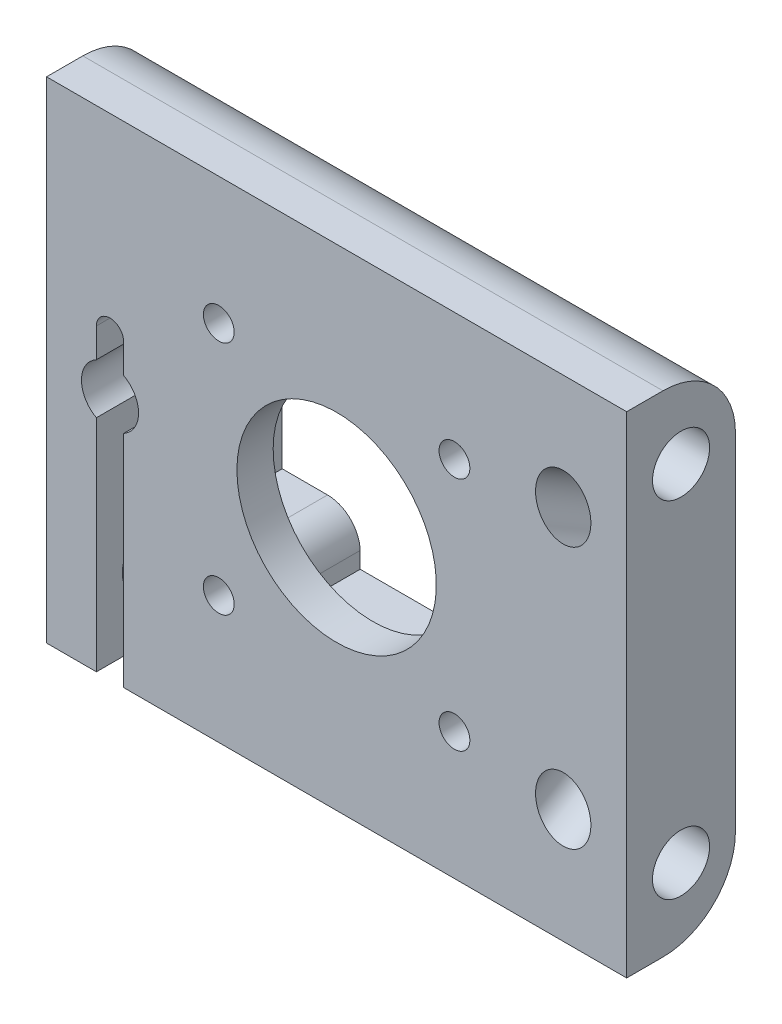
from build123d import *

# Parameters (mm, degrees)
SKETCH1_W           = 64
SKETCH1_H           = 54.105
BOSS_EXTRUDE1_DEPTH = 12
SKETCH2_R           = 3.15
CUT_EXTRUDE1_DEPTH  = 85.660209219
FILLET1_R           = 8
SKETCH3_R           = 11
SKETCH3_R_2         = 1.7
CUT_EXTRUDE2_DEPTH  = 85.660209219
CUT_EXTRUDE4_DEPTH  = 8
CUT_EXTRUDE5_START  = -85.903698808
SKETCH6_R           = 3.05
CUT_EXTRUDE5_DEPTH  = 93.903698808


with BuildPart() as part:
    # Sketch1 → Boss-Extrude1 (new body)
    with BuildSketch(Plane.XY):
        with Locations((32, 27.0525)):
            Rectangle(SKETCH1_W, SKETCH1_H)
    extrude(amount=BOSS_EXTRUDE1_DEPTH)

    # Sketch2 → Cut-Extrude1 (cut, through all)
    with BuildSketch(Plane(origin=(0, 0, 0), x_dir=(0, 0, -1), z_dir=(1, 0, 0))):
        with Locations((-6, 46.105)):
            Circle(SKETCH2_R)
        with Locations(Location((-6, 8, 0), (0, 0, 180))):
            Circle(SKETCH2_R)
    extrude(amount=CUT_EXTRUDE1_DEPTH, mode=Mode.SUBTRACT)

    # Fillet1
    fillet1_edges = [part.edges().sort_by_distance(p)[0] for p in [
        (32, 54.105, 0),
        (32, 0, 0),
    ]]
    fillet(fillet1_edges, radius=FILLET1_R)

    # Sketch3 → Cut-Extrude2 (cut, through all)
    with BuildSketch(Plane(origin=(0, 0, 0), x_dir=(-1, 0, 0), z_dir=(0, 0, -1))):
        with Locations((-32, 27.0525)):
            Circle(SKETCH3_R)
        with Locations((-19, 40.0525)):
            Circle(SKETCH3_R_2)
        with Locations((-19, 14.0525)):
            Circle(SKETCH3_R_2)
        with Locations((-45, 14.0525)):
            Circle(SKETCH3_R_2)
        with Locations((-45, 40.0525)):
            Circle(SKETCH3_R_2)
        with BuildLine():
            Line((-8.5, 0), (-8.5, 24.282572203))
            ThreePointArc((-8.5, 24.282572203), (-10.15, 27.0525), (-8.5, 29.822427797))
            Line((-8.5, 29.822427797), (-8.5, 33.0525))
            ThreePointArc((-8.5, 33.0525), (-7, 34.5525), (-5.5, 33.0525))
            Line((-5.5, 33.0525), (-5.5, 29.822427797))
            ThreePointArc((-5.5, 29.822427797), (-3.85, 27.0525), (-5.5, 24.282572203))
            Line((-5.5, 24.282572203), (-5.5, 0))
            Line((-5.5, 0), (-8.5, 0))
        make_face()
    extrude(amount=-CUT_EXTRUDE2_DEPTH, mode=Mode.SUBTRACT)

    # Sketch5 → Cut-Extrude4 (cut)
    with BuildSketch(Plane(origin=(0, 0, 0), x_dir=(-1, 0, 0), z_dir=(0, 0, -1))):
        with BuildLine():
            Line((-19, 17.6525), (-14, 17.6525))
            Line((-14, 17.6525), (-14, 36.4525))
            Line((-14, 36.4525), (-19, 36.4525))
            ThreePointArc((-19, 36.4525), (-21.510876341, 37.472674425), (-22.598679445, 39.955))
            Line((-22.598679445, 39.955), (-22.598679445, 41.7525))
            Line((-22.598679445, 41.7525), (-41.401320555, 41.7525))
            Line((-41.401320555, 41.7525), (-41.401320555, 39.955))
            ThreePointArc((-41.401320555, 39.955), (-42.489123659, 37.472674425), (-45, 36.4525))
            Line((-45, 36.4525), (-50, 36.4525))
            Line((-50, 36.4525), (-50, 17.6525))
            Line((-50, 17.6525), (-45, 17.6525))
            ThreePointArc((-45, 17.6525), (-42.489123659, 16.632325575), (-41.401320555, 14.15))
            Line((-41.401320555, 14.15), (-41.401320555, 12.3525))
            Line((-41.401320555, 12.3525), (-22.598679445, 12.3525))
            Line((-22.598679445, 12.3525), (-22.598679445, 14.15))
            ThreePointArc((-22.598679445, 14.15), (-21.510876341, 16.632325575), (-19, 17.6525))
        make_face()
    extrude(amount=-CUT_EXTRUDE4_DEPTH, mode=Mode.SUBTRACT)

    # Sketch6 → Cut-Extrude5 (cut)
    with BuildSketch(Plane(origin=(0, -0.598076211, 1.035898385), x_dir=(1, 0, 0), z_dir=(0, 0.49999999999999495, -0.8660254037844416)).offset(CUT_EXTRUDE5_START)):
        with Locations(Location((57, -16.92820323, 0), (0, 0, 90))):
            Circle(SKETCH6_R)
    cut_extrude5 = extrude(amount=CUT_EXTRUDE5_DEPTH, mode=Mode.SUBTRACT)

    # Mirror1: Cut-Extrude5 across plane
    add(cut_extrude5.mirror(Plane.ZX.offset(27.0525)), mode=Mode.SUBTRACT)


solid = part.part
